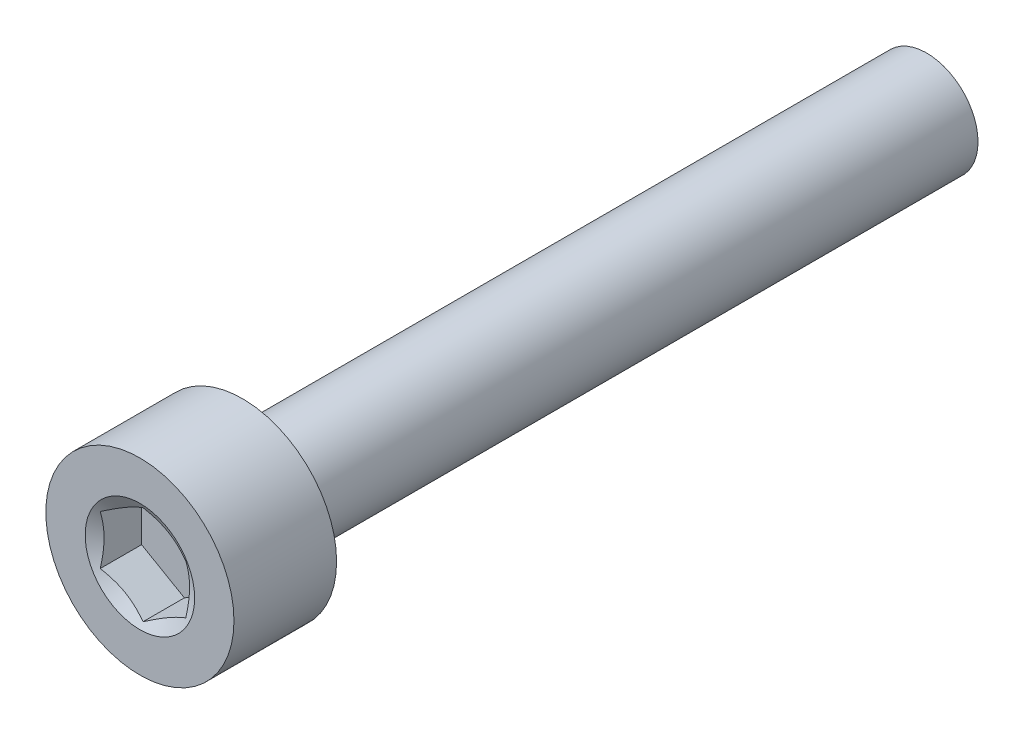
from build123d import *

# Parameters (mm, degrees)
SKE1_R      = 2.75
BASE1_DEPTH = 3
BODYSKE_W   = 23
BODYSKE_H   = 1.5
HEX_2_DEPTH = 1.3


with BuildPart() as part:
    # Ske1 → Base1 (new body)
    with BuildSketch(Plane.XY):
        Circle(SKE1_R)
    extrude(amount=BASE1_DEPTH)

    # BodySke → BaseBody (revolve)
    with BuildSketch(Plane(origin=(0, 0, 0), x_dir=(0, 0, -1), z_dir=(1, 0, 0)), mode=Mode.PRIVATE) as basebody_sk:
        with Locations((8.5, 0.75)):
            Rectangle(BODYSKE_W, BODYSKE_H)
    revolve(basebody_sk.sketch.rotate(Axis((0, 0, 1.385793675), (0, 0, -1)), 90), axis=Axis((0, 0, 1.385793675), (0, 0, -1)))

    # Ske8 → Hex 2 (cut)
    with BuildSketch(Plane.XY.offset(3)):
        Polygon((0, 1.443375673), (-1.25, 0.721687836), (-1.25, -0.721687836), (0, -1.443375673), (1.25, -0.721687836), (1.25, 0.721687836), align=None)
    extrude(amount=-HEX_2_DEPTH, mode=Mode.SUBTRACT)

    # Chamfer 2 cone 1 section (through the dimple's axis) → Chamfer 2 (revolve, cut)
    with BuildSketch(Plane(origin=(0, 0, 3), x_dir=(0, -1, 0), z_dir=(1, 0, 0))):
        Polygon((0, 0), (1.6, 0), (0, 0.923760431), align=None)
    revolve(axis=Axis((0, 0, 3), (0, 0, -1)), mode=Mode.SUBTRACT)


solid = part.part
